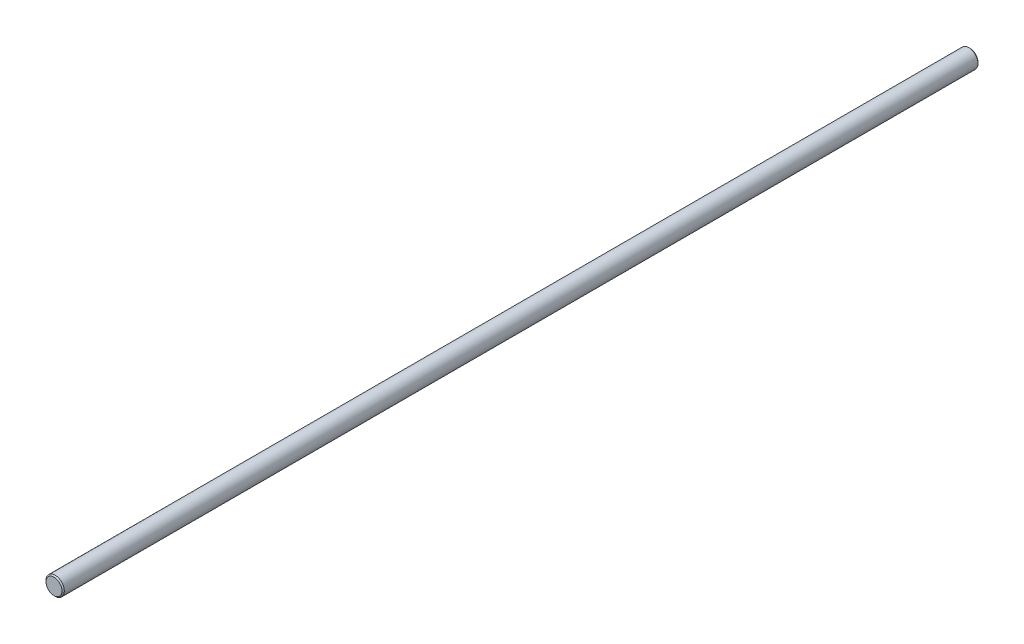
from build123d import *

# Parameters (mm, degrees)
SKETCH2_R           = 6
BOSS_EXTRUDE1_DEPTH = 300
CHAMFER1_SIZE       = 0.75


with BuildPart() as part:
    # Sketch2 → Boss-Extrude1 (new, symmetric)
    with BuildSketch(Plane.XY):
        Circle(SKETCH2_R)
    extrude(amount=BOSS_EXTRUDE1_DEPTH, both=True)

    # Chamfer1
    chamfer1_edges = [part.edges().sort_by_distance(p)[0] for p in [
        (-6, 0, -300),
        (-6, 0, 300),
    ]]
    chamfer(chamfer1_edges, length=CHAMFER1_SIZE)


solid = part.part
